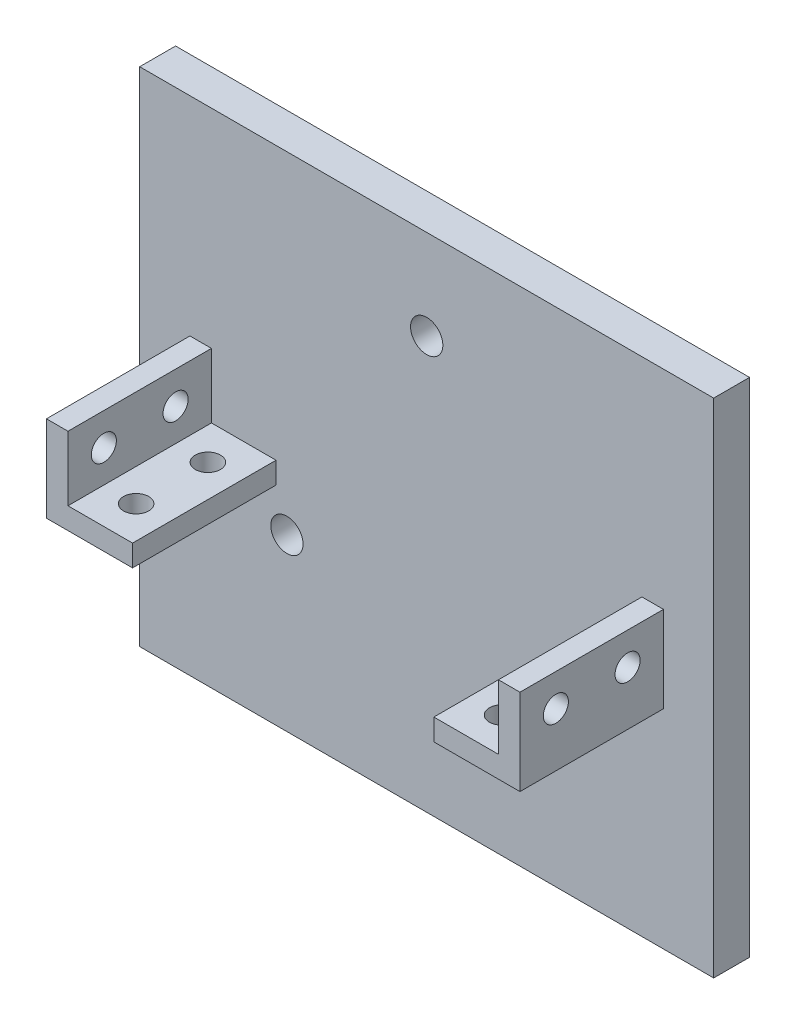
from build123d import *

# Parameters (mm, degrees)
SKETCH_1_W          = 80
SKETCH_1_H          = 70
EXTRUDE_1_DEPTH     = 5
EXTRUDE_2_DEPTH     = 20
SKETCH_3_R          = 1.75
CUT_EXTRUDE_1_DEPTH = 85.728979694
SKETCH_4_R          = 1.75
CUT_EXTRUDE_2_DEPTH = 63.497999968
SKETCH_5_R          = 2.25
CUT_EXTRUDE_3_DEPTH = 57.789083458


with BuildPart() as part:
    # ｽｹｯﾁ1 → ﾎﾞｽ - 押し出し1 (new body)
    with BuildSketch(Plane.XY):
        Rectangle(SKETCH_1_W, SKETCH_1_H)
    extrude(amount=EXTRUDE_1_DEPTH)

    # ｽｹｯﾁ2 → ﾎﾞｽ - 押し出し2 (add)
    with BuildSketch(Plane.XY.offset(5)):
        Polygon((-30, -3), (-21, -3), (-21, -6), (-33, -6), (-33, 6), (-30, 6), align=None)
        Polygon((21, -3), (21, -6), (33, -6), (33, 6), (30, 6), (30, -3), align=None)
    extrude(amount=EXTRUDE_2_DEPTH)

    # ｽｹｯﾁ3 → ｶｯﾄ - 押し出し1 (cut, through all)
    with BuildSketch(Plane(origin=(33, 0, 0), x_dir=(0, 0, -1), z_dir=(1, 0, 0))):
        with Locations(Location((-10, 1.5, 0), (0, 0, 90))):
            Circle(SKETCH_3_R)
        with Locations(Location((-20, 1.5, 0), (0, 0, 90))):
            Circle(SKETCH_3_R)
    extrude(amount=-CUT_EXTRUDE_1_DEPTH, mode=Mode.SUBTRACT)

    # ｽｹｯﾁ4 → ｶｯﾄ - 押し出し2 (cut, through all)
    with BuildSketch(Plane.XZ.offset(6)):
        with Locations((25.5, 10)):
            Circle(SKETCH_4_R)
        with Locations((25.5, 20)):
            Circle(SKETCH_4_R)
        with Locations((-25.5, 10)):
            Circle(SKETCH_4_R)
        with Locations((-25.5, 20)):
            Circle(SKETCH_4_R)
    extrude(amount=-CUT_EXTRUDE_2_DEPTH, mode=Mode.SUBTRACT)

    # ｽｹｯﾁ5 → ｶｯﾄ - 押し出し3 (cut, through all)
    with BuildSketch(Plane.XY.offset(5)):
        with Locations((0, 22.5)):
            Circle(SKETCH_5_R)
        with Locations((19.485571585, -11.25)):
            Circle(SKETCH_5_R)
        with Locations((-19.485571585, -11.25)):
            Circle(SKETCH_5_R)
    extrude(amount=-CUT_EXTRUDE_3_DEPTH, mode=Mode.SUBTRACT)


solid = part.part
